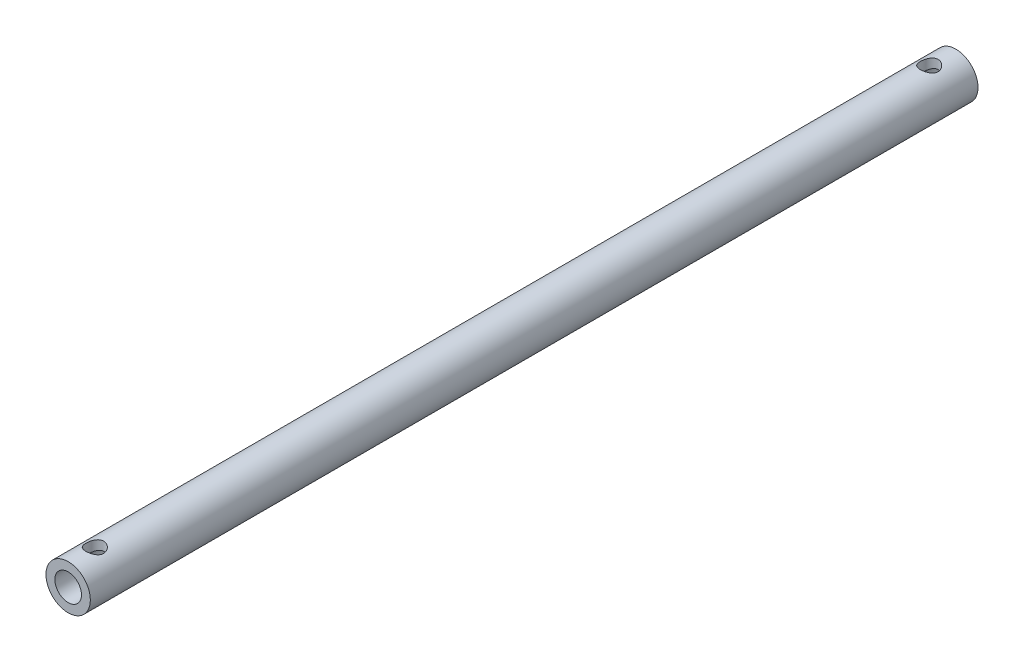
from build123d import *

# Parameters (mm, degrees)
ESQUISSE1_R             = 2.5
ESQUISSE1_R_2           = 1.5
BOSS_EXTRU_1_DEPTH      = 100
ESQUISSE2_R             = 1
ENL_V_MAT_EXTRU_1_DEPTH = 101.399348663


with BuildPart() as part:
    # Esquisse1 → Boss.-Extru.1 (new body)
    with BuildSketch(Plane.XY):
        with Locations((-4.918167702, 1.104491281)):
            Circle(ESQUISSE1_R)
        with Locations((-4.918167702, 1.104491281)):
            Circle(ESQUISSE1_R_2, mode=Mode.SUBTRACT)
    extrude(amount=BOSS_EXTRU_1_DEPTH)

    # Esquisse2 → Enlèv. mat.-Extru.1 (cut, through all)
    with BuildSketch(Plane(origin=(0, 3.604491281, 0), x_dir=(1, 0, 0), z_dir=(0, 1, 0))):
        with Locations(Location((-4.918167702, -3, 0), (0, 0, 270))):
            Circle(ESQUISSE2_R)
        with Locations(Location((-4.918167702, -97, 0), (0, 0, 270))):
            Circle(ESQUISSE2_R)
    extrude(amount=-ENL_V_MAT_EXTRU_1_DEPTH, mode=Mode.SUBTRACT)


solid = part.part
